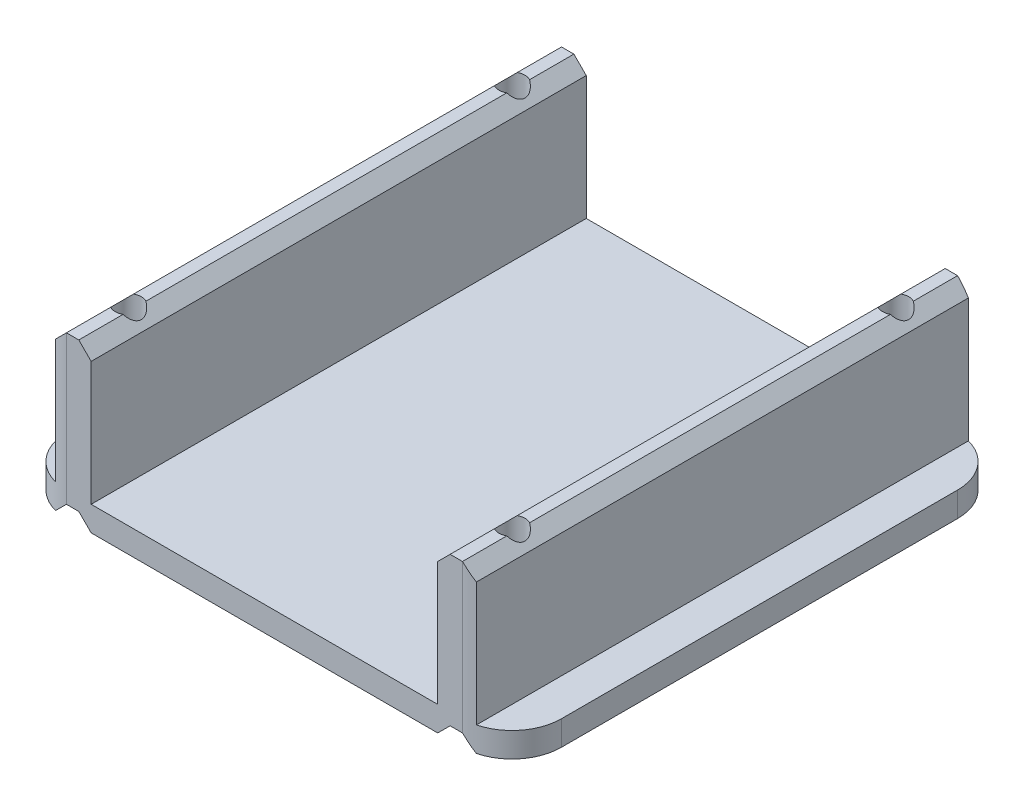
from build123d import *

# Parameters (mm, degrees)
SKETCH1_W           = 40
SKETCH1_H           = 40
BOSS_EXTRUDE1_DEPTH = 2
CUT_EXTRUDE1_DEPTH  = 45.766058571
BOSS_EXTRUDE2_START = -40
BOSS_EXTRUDE2_DEPTH = 40
FILLET1_R           = 4
SKETCH6_R           = 1.05
CUT_EXTRUDE4_DEPTH  = 32.128764833


with BuildPart() as part:
    # Sketch1 → Boss-Extrude1 (new body)
    with BuildSketch(Plane(origin=(0, 0, 0), x_dir=(1, 0, 0), z_dir=(0, 1, 0))):
        Rectangle(SKETCH1_W, SKETCH1_H)
    extrude(amount=BOSS_EXTRUDE1_DEPTH)

    # Sketch2 → Cut-Extrude1 (cut, through all)
    with BuildSketch(Plane.XY.offset(20)):
        Polygon((14, 0), (15, 1), (16, 1), (17, 0), align=None)
    cut_extrude1 = extrude(amount=-CUT_EXTRUDE1_DEPTH, mode=Mode.SUBTRACT)

    # Sketch3 → Boss-Extrude2 (add)
    with BuildSketch(Plane.XY.offset(20).offset(BOSS_EXTRUDE2_START)):
        Polygon((17, 12), (16, 13), (15, 13), (14, 12), (14, 2), (17, 2), align=None)
    boss_extrude2 = extrude(amount=BOSS_EXTRUDE2_DEPTH)

    # Mirror2: Cut-Extrude1, Boss-Extrude2 across plane
    add(cut_extrude1.mirror(Plane(origin=(0, 0, 0), x_dir=(0, 0, 1), z_dir=(1, 0, 0))), mode=Mode.SUBTRACT)
    add(boss_extrude2.mirror(Plane(origin=(0, 0, 0), x_dir=(0, 0, 1), z_dir=(1, 0, 0))))

    # Fillet1
    fillet1_edges = [part.edges().sort_by_distance(p)[0] for p in [
        (-20, 1, 20),
        (20, 1, 20),
        (20, 1, -20),
        (-20, 1, -20),
    ]]
    fillet(fillet1_edges, radius=FILLET1_R)

    # Sketch6 → Cut-Extrude4 (cut, through all)
    with BuildSketch(Plane(origin=(0, 0, 0), x_dir=(1, 0, 0), z_dir=(0, 1, 0))):
        with Locations(Location((-15.5, 15.5, 0), (0, 0, 61.563109851))):
            Circle(SKETCH6_R)
        with Locations(Location((15.5, 15.5, 0), (0, 0, 61.563109851))):
            Circle(SKETCH6_R)
        with Locations(Location((-15.5, -15.5, 0), (0, 0, 61.563109851))):
            Circle(SKETCH6_R)
        with Locations(Location((15.5, -15.5, 0), (0, 0, 61.563109851))):
            Circle(SKETCH6_R)
    extrude(amount=CUT_EXTRUDE4_DEPTH, mode=Mode.SUBTRACT)


solid = part.part
